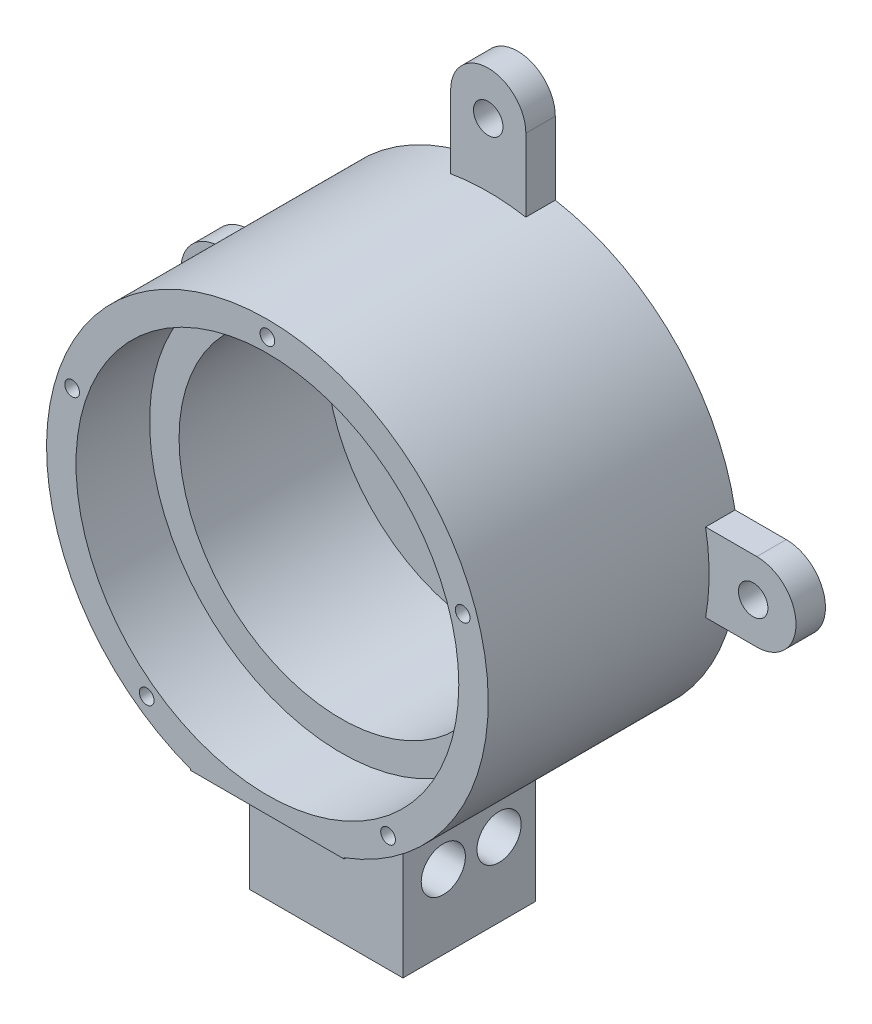
from build123d import *

# Parameters (mm, degrees)
SKETCH2_R               = 75
BOSS_EXTRUDE1_DEPTH     = 85
SKETCH4_R               = 65
CUT_EXTRUDE2_DEPTH      = 25
SKETCH5_R               = 55
CUT_EXTRUDE3_DEPTH      = 50
SKETCH7_R               = 2.5
CUT_EXTRUDE4_DEPTH      = 20
CIRPATTERN1_COUNT       = 5
BOSS_EXTRUDE2_DEPTH     = 85
CUT_EXTRUDE9_DEPTH      = 222.85434026
CUT_EXTRUDE9_DEPTH_BACK = 45
SKETCH29_W              = 52.076433836
SKETCH29_H              = 20
SKETCH23_R              = 7.5
CUT_EXTRUDE8_DEPTH      = 176.561799548
BOSS_EXTRUDE4_DEPTH     = 10
BOSS_EXTRUDE5_DEPTH     = 10
SKETCH32_R              = 5
CUT_EXTRUDE10_DEPTH     = 10


with BuildPart() as part:
    # Sketch2 → Boss-Extrude1 (new body)
    with BuildSketch(Plane(origin=(0, 0, 0), x_dir=(0, 1, 0), z_dir=(0, 0, 1))):
        with Locations(Location((0, 0, 0), (0, 0, 270))):
            Circle(SKETCH2_R)
    extrude(amount=BOSS_EXTRUDE1_DEPTH)

    # Sketch4 → Cut-Extrude2 (cut)
    with BuildSketch(Plane.XY.offset(85)):
        Circle(SKETCH4_R)
    extrude(amount=-CUT_EXTRUDE2_DEPTH, mode=Mode.SUBTRACT)

    # Sketch5 → Cut-Extrude3 (cut)
    with BuildSketch(Plane.XY.offset(60)):
        Circle(SKETCH5_R)
    extrude(amount=-CUT_EXTRUDE3_DEPTH, mode=Mode.SUBTRACT)

    # Sketch7 → Cut-Extrude4 (cut)
    with BuildSketch(Plane.XY.offset(85)):
        with Locations((0, 69.72339814)):
            Circle(SKETCH7_R)
    cut_extrude4 = extrude(amount=-CUT_EXTRUDE4_DEPTH, mode=Mode.SUBTRACT)

    # CirPattern1: Cut-Extrude4 ×5 about axis
    cirpattern1_axis = Axis((0, 0, 0), (0, 0, 1))
    for i in range(1, CIRPATTERN1_COUNT):
        add(cut_extrude4.rotate(cirpattern1_axis, i * 360 / CIRPATTERN1_COUNT), mode=Mode.SUBTRACT)

    # Sketch15 → Boss-Extrude2 (add)
    with BuildSketch(Plane(origin=(0, 0, 0), x_dir=(1, 0, 0), z_dir=(0, 0, -1))):
        Polygon((0, 70.334993138), (26.038216918, 70.334993138), (26.038216918, 115.707494064), (-26.038216918, 115.707494064), (-26.038216918, 70.334993138), align=None)
    extrude(amount=-BOSS_EXTRUDE2_DEPTH)

    # Sketch29 → Cut-Extrude9 (cut, two sides: drawn at the far end of the back side and taken through both)
    with BuildSketch(Plane.XZ.offset(115.707494064).offset(-CUT_EXTRUDE9_DEPTH_BACK)):
        with Locations((0, 75)):
            Rectangle(SKETCH29_W, SKETCH29_H)
        with Locations((0, 10)):
            Rectangle(SKETCH29_W, SKETCH29_H)
    extrude(amount=CUT_EXTRUDE9_DEPTH + CUT_EXTRUDE9_DEPTH_BACK, mode=Mode.SUBTRACT)

    # Sketch23 → Cut-Extrude8 (cut, through all)
    with BuildSketch(Plane(origin=(-26.038216918, 0, 0), x_dir=(0, -1, 0), z_dir=(-1, 0, 0))):
        with Locations((90.556929386, 51.29930896)):
            Circle(SKETCH23_R)
        with Locations((90.556929386, 32.361665764)):
            Circle(SKETCH23_R)
    extrude(amount=-CUT_EXTRUDE8_DEPTH, mode=Mode.SUBTRACT)

    # Sketch30 → Boss-Extrude4 (add)
    with BuildSketch(Plane(origin=(0, 0, 0), x_dir=(1, 0, 0), z_dir=(0, 0, -1))):
        with BuildLine():
            Line((-91.060110116, 13.313174206), (91.197550371, 13.313174206))
            ThreePointArc((91.197550371, 13.313174206), (104.510724577, 0), (91.197550371, -13.313174206))
            Line((91.197550371, -13.313174206), (-91.060110116, -13.313174206))
            ThreePointArc((-91.060110116, -13.313174206), (-104.373284322, 0), (-91.060110116, 13.313174206))
        make_face()
    extrude(amount=-BOSS_EXTRUDE4_DEPTH)

    # Sketch31 → Boss-Extrude5 (add)
    with BuildSketch(Plane(origin=(0, 0, 0), x_dir=(1, 0, 0), z_dir=(0, 0, -1))):
        with BuildLine():
            Line((12.768161156, -41.533975832), (12.768161156, -98.589265102))
            ThreePointArc((12.768161156, -98.589265102), (0, -111.357426258), (-12.768161156, -98.589265102))
            Line((-12.768161156, -98.589265102), (-12.768161156, -41.533975832))
            ThreePointArc((-12.768161156, -41.533975832), (0, -28.765814675), (12.768161156, -41.533975832))
        make_face()
    extrude(amount=-BOSS_EXTRUDE5_DEPTH)

    # Sketch32 → Cut-Extrude10 (cut)
    with BuildSketch(Plane.XY.offset(10)):
        with Locations((-89.533828586, 0)):
            Circle(SKETCH32_R)
        with Locations((0, 96.564616818)):
            Circle(SKETCH32_R)
        with Locations((89.966014067, 0)):
            Circle(SKETCH32_R)
    extrude(amount=-CUT_EXTRUDE10_DEPTH, mode=Mode.SUBTRACT)


solid = part.part
